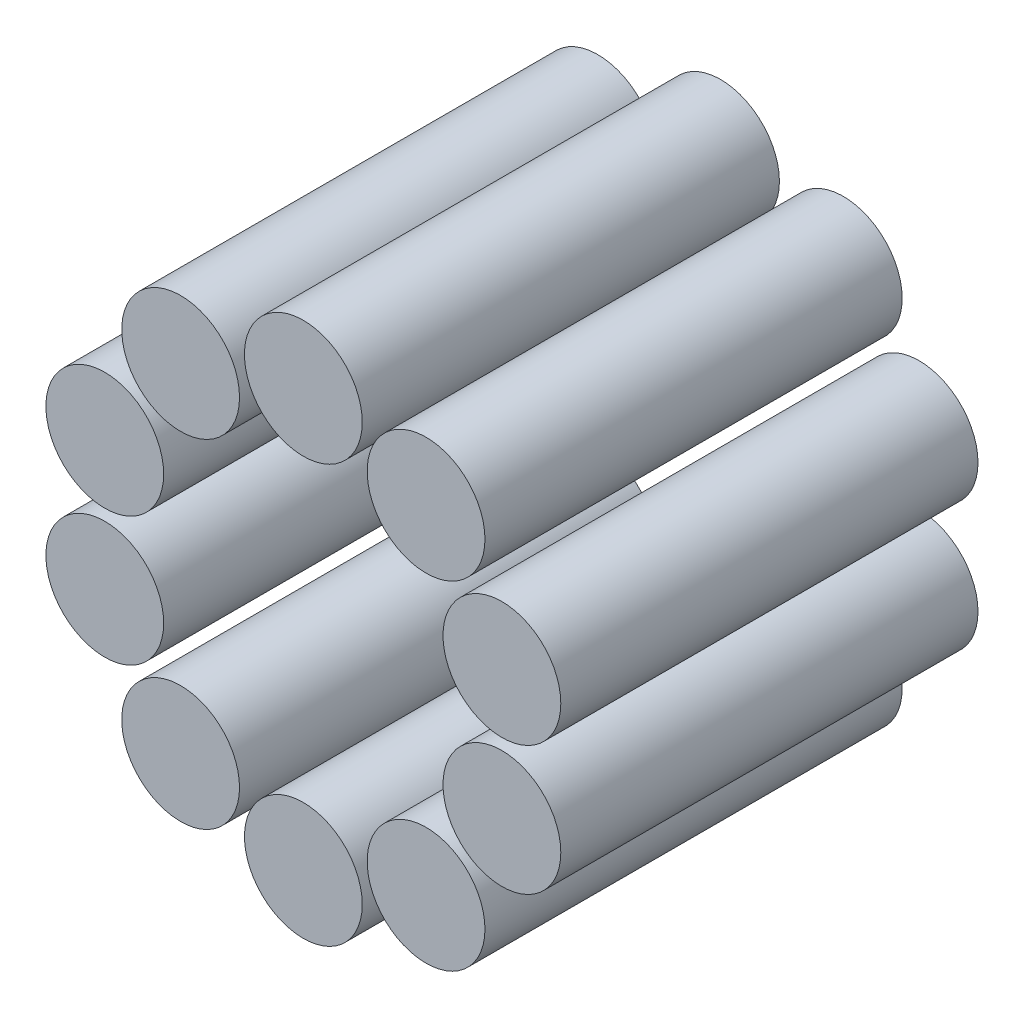
from build123d import *

# Parameters (mm, degrees)
SKETCH2_R              = 9.175
BOSS_EXTRUDE1_DEPTH    = 65
BOSS_EXTRUDE1_2_DEPTH  = 65
BOSS_EXTRUDE1_3_DEPTH  = 65
BOSS_EXTRUDE1_4_DEPTH  = 65
BOSS_EXTRUDE1_5_DEPTH  = 65
BOSS_EXTRUDE1_6_DEPTH  = 65
BOSS_EXTRUDE1_7_DEPTH  = 65
BOSS_EXTRUDE1_8_DEPTH  = 65
BOSS_EXTRUDE1_9_DEPTH  = 65
BOSS_EXTRUDE1_10_DEPTH = 65


with BuildPart() as part:
    # Sketch2 → Boss-Extrude1 (new body)
    with BuildSketch(Plane.XY):
        with Locations((0, -32.53)):
            Circle(SKETCH2_R)
    extrude(amount=BOSS_EXTRUDE1_DEPTH)


with BuildPart() as body_2:
    # Sketch2 → Boss-Extrude1 2 (new body)
    with BuildSketch(Plane.XY):
        with Locations((-19.120654257, -26.317322827)):
            Circle(SKETCH2_R)
    extrude(amount=BOSS_EXTRUDE1_2_DEPTH)


with BuildPart() as body_3:
    # Sketch2 → Boss-Extrude1 3 (new body)
    with BuildSketch(Plane.XY):
        with Locations((-30.937868475, -10.052322827)):
            Circle(SKETCH2_R)
    extrude(amount=BOSS_EXTRUDE1_3_DEPTH)


with BuildPart() as body_4:
    # Sketch2 → Boss-Extrude1 4 (new body)
    with BuildSketch(Plane.XY):
        with Locations((-30.937868475, 10.052322827)):
            Circle(SKETCH2_R)
    extrude(amount=BOSS_EXTRUDE1_4_DEPTH)


with BuildPart() as body_5:
    # Sketch2 → Boss-Extrude1 5 (new body)
    with BuildSketch(Plane.XY):
        with Locations((-19.120654257, 26.317322827)):
            Circle(SKETCH2_R)
    extrude(amount=BOSS_EXTRUDE1_5_DEPTH)


with BuildPart() as body_6:
    # Sketch2 → Boss-Extrude1 6 (new body)
    with BuildSketch(Plane.XY):
        with Locations((0, 32.53)):
            Circle(SKETCH2_R)
    extrude(amount=BOSS_EXTRUDE1_6_DEPTH)


with BuildPart() as body_7:
    # Sketch2 → Boss-Extrude1 7 (new body)
    with BuildSketch(Plane.XY):
        with Locations((19.120654257, 26.317322827)):
            Circle(SKETCH2_R)
    extrude(amount=BOSS_EXTRUDE1_7_DEPTH)


with BuildPart() as body_8:
    # Sketch2 → Boss-Extrude1 8 (new body)
    with BuildSketch(Plane.XY):
        with Locations((30.937868475, 10.052322827)):
            Circle(SKETCH2_R)
    extrude(amount=BOSS_EXTRUDE1_8_DEPTH)


with BuildPart() as body_9:
    # Sketch2 → Boss-Extrude1 9 (new body)
    with BuildSketch(Plane.XY):
        with Locations((30.937868475, -10.052322827)):
            Circle(SKETCH2_R)
    extrude(amount=BOSS_EXTRUDE1_9_DEPTH)


with BuildPart() as body_10:
    # Sketch2 → Boss-Extrude1 10 (new body)
    with BuildSketch(Plane.XY):
        with Locations((19.120654257, -26.317322827)):
            Circle(SKETCH2_R)
    extrude(amount=BOSS_EXTRUDE1_10_DEPTH)


solid = Compound([part.part, body_2.part, body_3.part, body_4.part, body_5.part, body_6.part, body_7.part, body_8.part, body_9.part, body_10.part])
